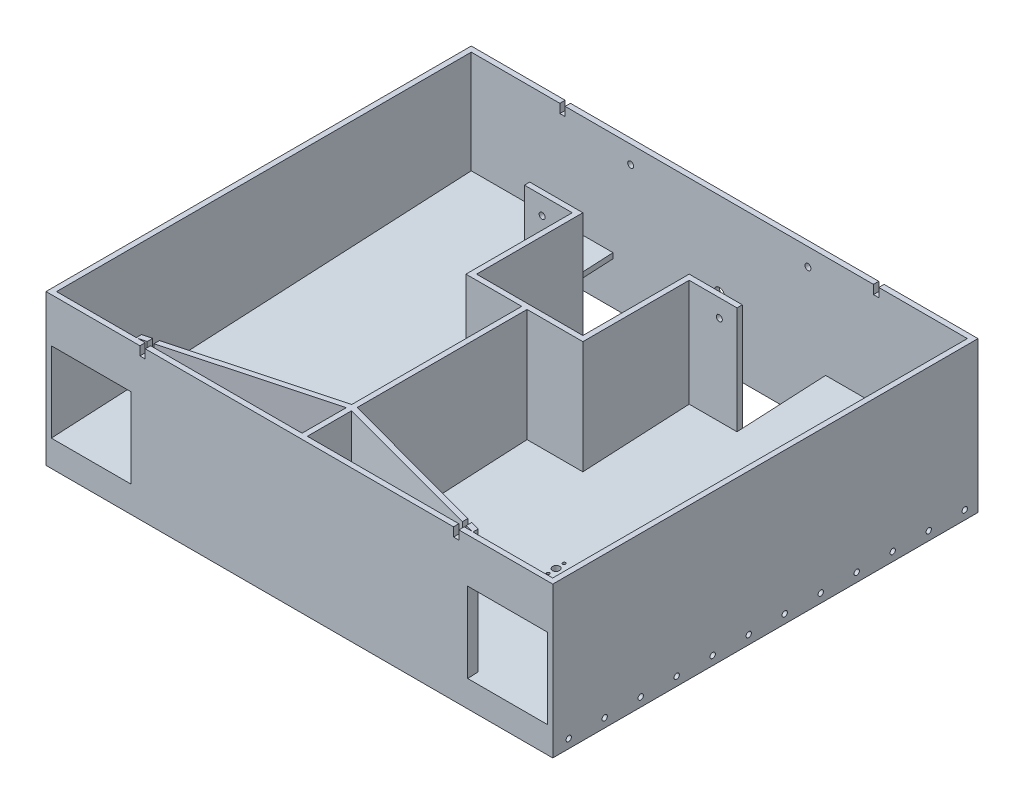
from build123d import *

# Parameters (mm, degrees)
SKETCH_1_W             = 286
SKETCH_1_H             = 240
SKETCH_1_W_2           = 280
SKETCH_1_H_2           = 234
EXTRUDE_1_DEPTH        = 85
EXTRUDE_2_DEPTH        = 280
CUT_EXTRUDE_1_REACH    = 207.119
SKETCH_3_W             = 45
SKETCH_3_H             = 3
CUT_EXTRUDE_2_DEPTH    = 206.119477378
EXTRUDE_3_REACH        = 207.119
SKETCH_7_W             = 45
SKETCH_7_H             = 2.948277695
EXTRUDE_4_DEPTH        = 25
SKETCH_8_W             = 120
SKETCH_8_H             = 12
EXTRUDE_5_DEPTH        = 3
CUT_EXTRUDE_3_REACH    = 294.017
SKETCH_9_R             = 1.7
SKETCH_9_R_2           = 3
CUT_EXTRUDE_4_REACH    = 254.535
SKETCH_10_R            = 1.7
SKETCH_11_R            = 1.5
CUT_EXTRUDE_5_DEPTH    = 322.591355605
PATTERN_LINEAR_1_COUNT = 12
PATTERN_LINEAR_1_PITCH = 20.32
EXTRUDE_6_REACH        = 200.914
CUT_EXTRUDE_7_REACH    = 306.054
SKETCH_17_W            = 3
SKETCH_17_H            = 5
CUT_EXTRUDE_8_REACH    = 200.018
SKETCH_18_R            = 2
SKETCH_18_R_2          = 0.8


with BuildPart() as part:
    # 草图1 → 凸台-拉伸1 (new body)
    with BuildSketch(Plane(origin=(0, 0, 0), x_dir=(1, 0, 0), z_dir=(0, 1, 0))):
        Rectangle(SKETCH_1_W, SKETCH_1_H)
        Rectangle(SKETCH_1_W_2, SKETCH_1_H_2, mode=Mode.SUBTRACT)
    extrude(amount=EXTRUDE_1_DEPTH)

    # 草图2 → 凸台-拉伸2 (add)
    with BuildSketch(Plane(origin=(-140, 0, 0), x_dir=(0, 0, -1), z_dir=(1, 0, 0))):
        Polygon((117, 27), (-117, 15), (-117, 11.996057817), (117, 23.996057817), align=None)
    extrude(amount=EXTRUDE_2_DEPTH)

    # 切除-拉伸1: up to this plane
    cut_extrude_1_end = Plane(origin=(374.480528575, 27, -117), z_dir=(0, -0.9986876634765887, -0.051214751973158404))
    # 草图3 → 切除-拉伸1 (cut, up to the surface)
    with BuildSketch(Plane(origin=(0, 85, 0), x_dir=(1, 0, 0), z_dir=(0, 1, 0)), mode=Mode.PRIVATE) as cut_extrude_1_sk1:
        with Locations((-117.5, -118.5)):
            Rectangle(SKETCH_3_W, SKETCH_3_H)
    cut_extrude_1_tool1 = split(extrude(cut_extrude_1_sk1.sketch, amount=-CUT_EXTRUDE_1_REACH, mode=Mode.PRIVATE), bisect_by=cut_extrude_1_end, keep=Keep.BOTH, mode=Mode.PRIVATE)
    add(cut_extrude_1_tool1.solids().sort_by_distance((-117.5, 85, 118.5))[0], mode=Mode.SUBTRACT)
    # 草图3 → 切除-拉伸1 (cut, up to the surface)
    with BuildSketch(Plane(origin=(0, 85, 0), x_dir=(1, 0, 0), z_dir=(0, 1, 0)), mode=Mode.PRIVATE) as cut_extrude_1_sk2:
        with Locations((117.5, -118.5)):
            Rectangle(SKETCH_3_W, SKETCH_3_H)
    cut_extrude_1_tool2 = split(extrude(cut_extrude_1_sk2.sketch, amount=-CUT_EXTRUDE_1_REACH, mode=Mode.PRIVATE), bisect_by=cut_extrude_1_end, keep=Keep.BOTH, mode=Mode.PRIVATE)
    add(cut_extrude_1_tool2.solids().sort_by_distance((117.5, 85, 118.5))[0], mode=Mode.SUBTRACT)

    # 草图5 → 切除-拉伸2 (cut, through all)
    with BuildSketch(Plane(origin=(0, 85, 0), x_dir=(1, 0, 0), z_dir=(0, 1, 0))):
        Polygon((-60, 117), (-60, 70), (-30, 70), (-30, 10), (30, 10), (30, 70), (60, 70), (60, 117), align=None)
    extrude(amount=-CUT_EXTRUDE_2_DEPTH, mode=Mode.SUBTRACT)

    # 凸台-拉伸3: up to this plane
    extrude_3_end = Plane(origin=(374.480528575, 27, -117), z_dir=(0, -0.9986876634765887, -0.051214751973158404))
    # 草图6 → 凸台-拉伸3 (add, up to the surface)
    with BuildSketch(Plane(origin=(0, 85, 0), x_dir=(1, 0, 0), z_dir=(0, 1, 0)), mode=Mode.PRIVATE) as extrude_3_sk1:
        Polygon((-33, 67), (-33, 7), (-1.5, 7), (-1.5, -88.892861075), (-95, -114.10344461), (-95, -117), (-94.218996239, -117), (-1.5, -92), (-1.5, -117), (1.5, -117), (1.5, -92), (94.218996239, -117), (95, -117), (95, -114.10344461), (1.5, -88.892861075), (1.5, 7), (33, 7), (33, 67), (60, 67), (60, 70), (30, 70), (30, 10), (-30, 10), (-30, 70), (-60, 70), (-60, 67), align=None)
    extrude_3_tool1 = split(extrude(extrude_3_sk1.sketch, amount=-EXTRUDE_3_REACH, mode=Mode.PRIVATE), bisect_by=extrude_3_end, keep=Keep.BOTH, mode=Mode.PRIVATE)
    add(extrude_3_tool1.solids().sort_by_distance((0, 85, 31.764205))[0])

    # 草图7 → 凸台-拉伸4 (add)
    with BuildSketch(Plane(origin=(0, 85, 0), x_dir=(1, 0, 0), z_dir=(0, 1, 0))):
        with Locations((-117.5, -118.525861153)):
            Rectangle(SKETCH_7_W, SKETCH_7_H)
        with Locations((117.5, -118.525861153)):
            Rectangle(SKETCH_7_W, SKETCH_7_H)
    extrude(amount=-EXTRUDE_4_DEPTH)

    # 草图8 → 凸台-拉伸5 (add)
    with BuildSketch(Plane(origin=(0, 0, -70), x_dir=(-1, 0, 0), z_dir=(0, 0, -1))):
        with Locations((0, 15.585801407)):
            Rectangle(SKETCH_8_W, SKETCH_8_H)
    extrude(amount=-EXTRUDE_5_DEPTH)

    # 切除-拉伸3: up to this face of the body (flat: up to its plane)
    cut_extrude_3_end = Plane(part.part.faces().sort_by_distance((-46.5, 54.717948718, -67))[0])
    # 草图9 → 切除-拉伸3 (cut, up to the picked face)
    with BuildSketch(Plane(origin=(0, 0, -120), x_dir=(-1, 0, 0), z_dir=(0, 0, -1)), mode=Mode.PRIVATE) as cut_extrude_3_sk1:
        with Locations((-50, 75)):
            Circle(SKETCH_9_R)
    cut_extrude_3_tool1 = split(extrude(cut_extrude_3_sk1.sketch, amount=-CUT_EXTRUDE_3_REACH, mode=Mode.PRIVATE), bisect_by=cut_extrude_3_end, keep=Keep.BOTH, mode=Mode.PRIVATE)
    # 草图9 → 切除-拉伸3 (cut, up to the picked face)
    with BuildSketch(Plane(origin=(0, 0, -120), x_dir=(-1, 0, 0), z_dir=(0, 0, -1)), mode=Mode.PRIVATE) as cut_extrude_3_sk2:
        with Locations((50, 75)):
            Circle(SKETCH_9_R)
    cut_extrude_3_tool2 = split(extrude(cut_extrude_3_sk2.sketch, amount=-CUT_EXTRUDE_3_REACH, mode=Mode.PRIVATE), bisect_by=cut_extrude_3_end, keep=Keep.BOTH, mode=Mode.PRIVATE)
    # 草图9 → 切除-拉伸3 (cut, up to the picked face)
    with BuildSketch(Plane(origin=(0, 0, -120), x_dir=(-1, 0, 0), z_dir=(0, 0, -1)), mode=Mode.PRIVATE) as cut_extrude_3_sk3:
        with Locations((0, 37)):
            Circle(SKETCH_9_R_2)
    cut_extrude_3_tool3 = split(extrude(cut_extrude_3_sk3.sketch, amount=-CUT_EXTRUDE_3_REACH, mode=Mode.PRIVATE), bisect_by=cut_extrude_3_end, keep=Keep.BOTH, mode=Mode.PRIVATE)
    add(cut_extrude_3_tool1.solids().sort_by(Axis((50, 75, -120), (0, 0, 1)))[0], mode=Mode.SUBTRACT)
    add(cut_extrude_3_tool2.solids().sort_by(Axis((-50, 75, -120), (0, 0, 1)))[0], mode=Mode.SUBTRACT)
    add(cut_extrude_3_tool3.solids().sort_by(Axis((0, 37, -120), (0, 0, 1)))[0], mode=Mode.SUBTRACT)

    # 草图10 → 切除-拉伸4 (cut, up to next)
    with BuildSketch(Plane(origin=(0, 0, -70), x_dir=(-1, 0, 0), z_dir=(0, 0, -1)), mode=Mode.PRIVATE) as cut_extrude_4_sk1:
        with Locations((-50, 16)):
            Circle(SKETCH_10_R)
    cut_extrude_4_tool1 = extrude(cut_extrude_4_sk1.sketch, amount=-CUT_EXTRUDE_4_REACH, mode=Mode.PRIVATE) & part.part
    # 草图10 → 切除-拉伸4 (cut, up to next)
    with BuildSketch(Plane(origin=(0, 0, -70), x_dir=(-1, 0, 0), z_dir=(0, 0, -1)), mode=Mode.PRIVATE) as cut_extrude_4_sk2:
        with Locations((50, 16)):
            Circle(SKETCH_10_R)
    cut_extrude_4_tool2 = extrude(cut_extrude_4_sk2.sketch, amount=-CUT_EXTRUDE_4_REACH, mode=Mode.PRIVATE) & part.part
    add(cut_extrude_4_tool1.solids().sort_by_distance((50, 16, -70))[0], mode=Mode.SUBTRACT)
    add(cut_extrude_4_tool2.solids().sort_by_distance((-50, 16, -70))[0], mode=Mode.SUBTRACT)

    # 草图11 → 切除-拉伸5 (cut, through all)
    with BuildSketch(Plane.ZY.offset(143)):
        with Locations((111, 5)):
            Circle(SKETCH_11_R)
    cut_extrude_5 = extrude(amount=-CUT_EXTRUDE_5_DEPTH, mode=Mode.SUBTRACT)

    # 阵列(线性)1: 切除-拉伸5 ×12
    with Locations(*[(0, 0, -i * PATTERN_LINEAR_1_PITCH) for i in range(1, PATTERN_LINEAR_1_COUNT)]):
        add(cut_extrude_5, mode=Mode.SUBTRACT)

    # 凸台-拉伸6: up to this plane
    extrude_6_end = Plane(origin=(60, 9.585801407, 53.598507453), z_dir=(0, -1, 0))
    # 草图12 → 凸台-拉伸6 (add, up to the surface)
    with BuildSketch(Plane(origin=(0, 17.948855042, 0.920454105), x_dir=(1, 0, 0), z_dir=(0, -0.9986876634765887, -0.051214751973158466)), mode=Mode.PRIVATE) as extrude_6_sk1:
        Polygon((-30, -68.009705726), (-30, -10.934804248), (30, -10.934804248), (30, -68.009705726), (33, -68.009705726), (33, -7.934804248), (1.5, -7.934804248), (1.5, 22.065195752), (-1.5, 22.065195752), (-1.5, -7.934804248), (-33, -7.934804248), (-33, -68.009705726), align=None)
    extrude_6_tool1 = split(extrude(extrude_6_sk1.sketch, amount=EXTRUDE_6_REACH, mode=Mode.PRIVATE), bisect_by=extrude_6_end, keep=Keep.BOTH, mode=Mode.PRIVATE)
    add(extrude_6_tool1.solids().sort_by_distance((-31.116669, 19.970417, -38.5))[0])
    # 草图12 → 凸台-拉伸6 (add, up to the surface)
    with BuildSketch(Plane(origin=(0, 17.948855042, 0.920454105), x_dir=(1, 0, 0), z_dir=(0, -0.9986876634765887, -0.051214751973158466)), mode=Mode.PRIVATE) as extrude_6_sk2:
        Polygon((-64.254065455, 107.984310804), (-25.63676826, 97.558172621), (-26.418728624, 94.661875331), (-65.036025818, 105.088013514), align=None)
    extrude_6_tool2 = split(extrude(extrude_6_sk2.sketch, amount=EXTRUDE_6_REACH, mode=Mode.PRIVATE), bisect_by=extrude_6_end, keep=Keep.BOTH, mode=Mode.PRIVATE)
    add(extrude_6_tool2.solids().sort_by_distance((-45.336397, 12.759618, 102.110577))[0])
    # 草图12 → 凸台-拉伸6 (add, up to the surface)
    with BuildSketch(Plane(origin=(0, 17.948855042, 0.920454105), x_dir=(1, 0, 0), z_dir=(0, -0.9986876634765887, -0.051214751973158466)), mode=Mode.PRIVATE) as extrude_6_sk3:
        Polygon((25.63676826, 97.558172621), (64.254065455, 107.984310804), (65.036025818, 105.088013514), (26.418728624, 94.661875331), align=None)
    extrude_6_tool3 = split(extrude(extrude_6_sk3.sketch, amount=EXTRUDE_6_REACH, mode=Mode.PRIVATE), bisect_by=extrude_6_end, keep=Keep.BOTH, mode=Mode.PRIVATE)
    add(extrude_6_tool3.solids().sort_by_distance((45.336397, 12.759618, 102.110577))[0])

    # 切除-拉伸7: up to this face of the body (flat: up to its plane)
    cut_extrude_7_end = Plane(part.part.faces().sort_by_distance((0, 43.519049567, 120))[0])
    # 草图17 → 切除-拉伸7 (cut, up to the picked face)
    with BuildSketch(Plane(origin=(0, -35, -120), x_dir=(1, 0, 0), z_dir=(0, 0, 1)), mode=Mode.PRIVATE) as cut_extrude_7_sk1:
        with Locations((88.5, 117.5)):
            Rectangle(SKETCH_17_W, SKETCH_17_H)
    cut_extrude_7_tool1 = split(extrude(cut_extrude_7_sk1.sketch, amount=CUT_EXTRUDE_7_REACH, mode=Mode.PRIVATE), bisect_by=cut_extrude_7_end, keep=Keep.BOTH, mode=Mode.PRIVATE)
    # 草图17 → 切除-拉伸7 (cut, up to the picked face)
    with BuildSketch(Plane(origin=(0, -35, -120), x_dir=(1, 0, 0), z_dir=(0, 0, 1)), mode=Mode.PRIVATE) as cut_extrude_7_sk2:
        with Locations((-88.5, 117.5)):
            Rectangle(SKETCH_17_W, SKETCH_17_H)
    cut_extrude_7_tool2 = split(extrude(cut_extrude_7_sk2.sketch, amount=CUT_EXTRUDE_7_REACH, mode=Mode.PRIVATE), bisect_by=cut_extrude_7_end, keep=Keep.BOTH, mode=Mode.PRIVATE)
    add(cut_extrude_7_tool1.solids().sort_by(Axis((88.5, 82.5, -120), (0, 0, 1)))[0], mode=Mode.SUBTRACT)
    add(cut_extrude_7_tool2.solids().sort_by(Axis((-88.5, 82.5, -120), (0, 0, 1)))[0], mode=Mode.SUBTRACT)

    # 草图18 → 切除-拉伸8 (cut, up to next)
    with BuildSketch(Plane(origin=(0, 20.944918033, 1.074098361), x_dir=(1, 0, 0), z_dir=(0, 0.9986876634765887, 0.0512147519731584)), mode=Mode.PRIVATE) as cut_extrude_8_sk1:
        with Locations(Location((-70, -44.08217753, 0), (0, 0, 270))):
            Circle(SKETCH_18_R)
    cut_extrude_8_tool1 = extrude(cut_extrude_8_sk1.sketch, amount=-CUT_EXTRUDE_8_REACH, mode=Mode.PRIVATE) & part.part
    # 草图18 → 切除-拉伸8 (cut, up to next)
    with BuildSketch(Plane(origin=(0, 20.944918033, 1.074098361), x_dir=(1, 0, 0), z_dir=(0, 0.9986876634765887, 0.0512147519731584)), mode=Mode.PRIVATE) as cut_extrude_8_sk2:
        with Locations(Location((-70, -39.58217753, 0), (0, 0, 270))):
            Circle(SKETCH_18_R_2)
    cut_extrude_8_tool2 = extrude(cut_extrude_8_sk2.sketch, amount=-CUT_EXTRUDE_8_REACH, mode=Mode.PRIVATE) & part.part
    # 草图18 → 切除-拉伸8 (cut, up to next)
    with BuildSketch(Plane(origin=(0, 20.944918033, 1.074098361), x_dir=(1, 0, 0), z_dir=(0, 0.9986876634765887, 0.0512147519731584)), mode=Mode.PRIVATE) as cut_extrude_8_sk3:
        with Locations(Location((-70, -48.58217753, 0), (0, 0, 270))):
            Circle(SKETCH_18_R_2)
    cut_extrude_8_tool3 = extrude(cut_extrude_8_sk3.sketch, amount=-CUT_EXTRUDE_8_REACH, mode=Mode.PRIVATE) & part.part
    # 草图18 → 切除-拉伸8 (cut, up to next)
    with BuildSketch(Plane(origin=(0, 20.944918033, 1.074098361), x_dir=(1, 0, 0), z_dir=(0, 0.9986876634765887, 0.0512147519731584)), mode=Mode.PRIVATE) as cut_extrude_8_sk4:
        with Locations(Location((70, -48.58217753, 0), (0, 0, 270))):
            Circle(SKETCH_18_R_2)
    cut_extrude_8_tool4 = extrude(cut_extrude_8_sk4.sketch, amount=-CUT_EXTRUDE_8_REACH, mode=Mode.PRIVATE) & part.part
    # 草图18 → 切除-拉伸8 (cut, up to next)
    with BuildSketch(Plane(origin=(0, 20.944918033, 1.074098361), x_dir=(1, 0, 0), z_dir=(0, 0.9986876634765887, 0.0512147519731584)), mode=Mode.PRIVATE) as cut_extrude_8_sk5:
        with Locations(Location((70, -39.58217753, 0), (0, 0, 270))):
            Circle(SKETCH_18_R_2)
    cut_extrude_8_tool5 = extrude(cut_extrude_8_sk5.sketch, amount=-CUT_EXTRUDE_8_REACH, mode=Mode.PRIVATE) & part.part
    # 草图18 → 切除-拉伸8 (cut, up to next)
    with BuildSketch(Plane(origin=(0, 20.944918033, 1.074098361), x_dir=(1, 0, 0), z_dir=(0, 0.9986876634765887, 0.0512147519731584)), mode=Mode.PRIVATE) as cut_extrude_8_sk6:
        with Locations(Location((70, -44.08217753, 0), (0, 0, 270))):
            Circle(SKETCH_18_R)
    cut_extrude_8_tool6 = extrude(cut_extrude_8_sk6.sketch, amount=-CUT_EXTRUDE_8_REACH, mode=Mode.PRIVATE) & part.part
    add(cut_extrude_8_tool1.solids().sort_by_distance((-70, 18.68726, 45.098425))[0], mode=Mode.SUBTRACT)
    add(cut_extrude_8_tool2.solids().sort_by_distance((-70, 18.917727, 40.604331))[0], mode=Mode.SUBTRACT)
    add(cut_extrude_8_tool3.solids().sort_by_distance((-70, 18.456794, 49.59252))[0], mode=Mode.SUBTRACT)
    add(cut_extrude_8_tool4.solids().sort_by_distance((70, 18.456794, 49.59252))[0], mode=Mode.SUBTRACT)
    add(cut_extrude_8_tool5.solids().sort_by_distance((70, 18.917727, 40.604331))[0], mode=Mode.SUBTRACT)
    add(cut_extrude_8_tool6.solids().sort_by_distance((70, 18.68726, 45.098425))[0], mode=Mode.SUBTRACT)


solid = part.part
